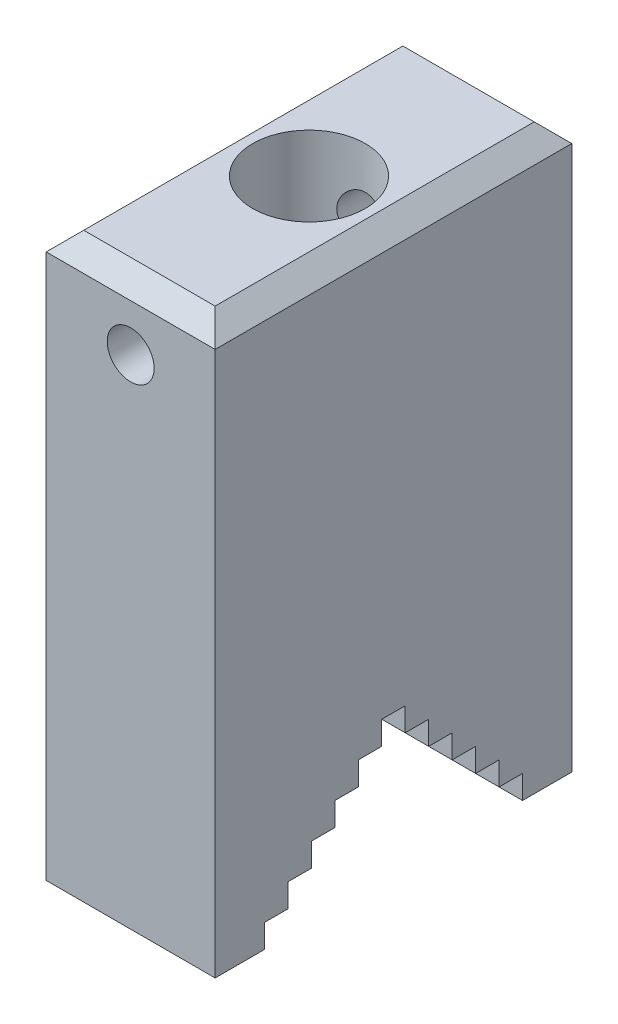
from build123d import *

# Parameters (mm, degrees)
BOSS_EXTRUDE1_DEPTH       = 9
CHAMFER1_SIZE             = 2
F_1_0MM_DOWEL_HOLE1_D     = 12
F_1_0MM_DOWEL_HOLE1_DEPTH = 18
F_1_0MM_DOWEL_HOLE1_TIP   = 3.464101615
M6X1_0_TAPPED_HOLE1_D     = 5


with BuildPart() as part:
    # Sketch1 → Boss-Extrude1 (new, symmetric)
    with BuildSketch(Plane(origin=(0, 0, 0), x_dir=(0, 0, -1), z_dir=(1, 0, 0))):
        Polygon((19, 60), (-19, 60), (-19, 0), (-13.75, 0), (-13.75, 2.5), (-11.25, 2.5), (-11.25, 5), (-8.75, 5), (-8.75, 7.5), (-6.25, 7.5), (-6.25, 10), (-3.75, 10), (-3.75, 12.5), (-1.25, 12.5), (-1.25, 15), (1.25, 15), (1.25, 12.5), (3.75, 12.5), (3.75, 10), (6.25, 10), (6.25, 7.5), (8.75, 7.5), (8.75, 5), (11.25, 5), (11.25, 2.5), (13.75, 2.5), (13.75, 0), (19, 0), align=None)
    extrude(amount=BOSS_EXTRUDE1_DEPTH, both=True)

    # Chamfer1
    chamfer1_edges = [part.edges().sort_by_distance(p)[0] for p in [
        (-9, 60, 0),
        (0, 60, 19),
        (0, 60, -19),
        (9, 60, 0),
    ]]
    chamfer(chamfer1_edges, length=CHAMFER1_SIZE)

    # Ø1.0mm Dowel Hole1
    with Locations(Plane(origin=(0, 60, 0), x_dir=(1, 0, 0), z_dir=(0, 1, 0))):
        with Locations((0, 0)):
            Hole(F_1_0MM_DOWEL_HOLE1_D / 2, depth=F_1_0MM_DOWEL_HOLE1_DEPTH)
            with Locations((0, 0, -(F_1_0MM_DOWEL_HOLE1_DEPTH + F_1_0MM_DOWEL_HOLE1_TIP / 2))):  # 120° drill point
                Cone(0, F_1_0MM_DOWEL_HOLE1_D / 2, F_1_0MM_DOWEL_HOLE1_TIP, mode=Mode.SUBTRACT)

    # M6x1.0 Tapped Hole1 (through all)
    with Locations(Plane.XY.offset(19)):
        with Locations((0, 53)):
            Hole(M6X1_0_TAPPED_HOLE1_D / 2)


solid = part.part
